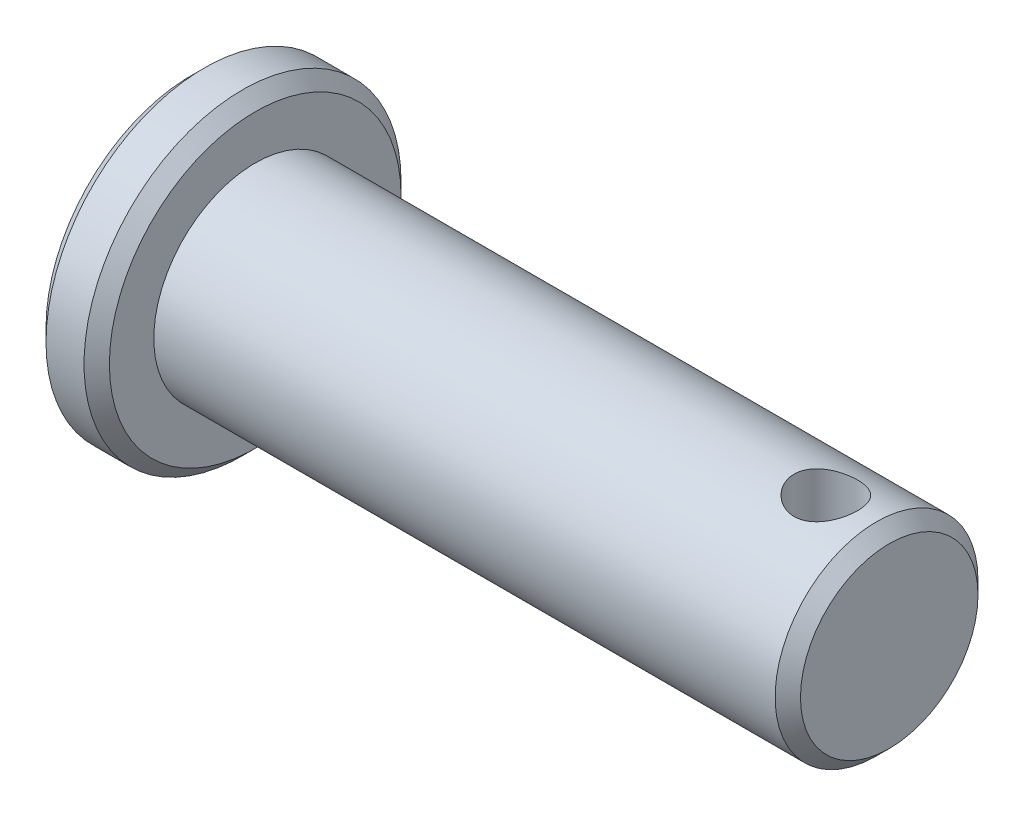
from build123d import *

# Parameters (mm, degrees)
CHAMFER_1_SIZE      = 1
CHAMFER_2_SIZE      = 1
SKETCH_2_R          = 2.5
CUT_EXTRUDE_1_DEPTH = 40


with BuildPart() as part:
    # 草图1 → 旋转1 (revolve)
    with BuildSketch(Plane.XY, mode=Mode.PRIVATE) as revolve_1_sk:
        Polygon((-55, 0), (-55, 12.5), (-50, 12.5), (-50, 8), (0, 8), (0, 0), align=None)
    revolve(revolve_1_sk.sketch.rotate(Axis((0, 0, 0), (-1, 0, 0)), 90), axis=Axis((0, 0, 0), (-1, 0, 0)))

    # 倒角1
    chamfer_1_edges = [part.edges().sort_by_distance(p)[0] for p in [
        (-50, 0, 12.5),
        (-55, 0, 12.5),
    ]]
    chamfer(chamfer_1_edges, length=CHAMFER_1_SIZE)

    # 倒角2
    chamfer_2_edges = [part.edges().sort_by_distance(p)[0] for p in [
        (0, 0, 8),
    ]]
    chamfer(chamfer_2_edges, length=CHAMFER_2_SIZE)

    # 草图2 → 切除-拉伸1 (cut, symmetric)
    with BuildSketch(Plane(origin=(0, 0, 0), x_dir=(1, 0, 0), z_dir=(0, 1, 0))):
        with Locations(Location((-5, 0, 0), (0, 0, 270))):
            Circle(SKETCH_2_R)
    extrude(amount=CUT_EXTRUDE_1_DEPTH, both=True, mode=Mode.SUBTRACT)


solid = part.part
